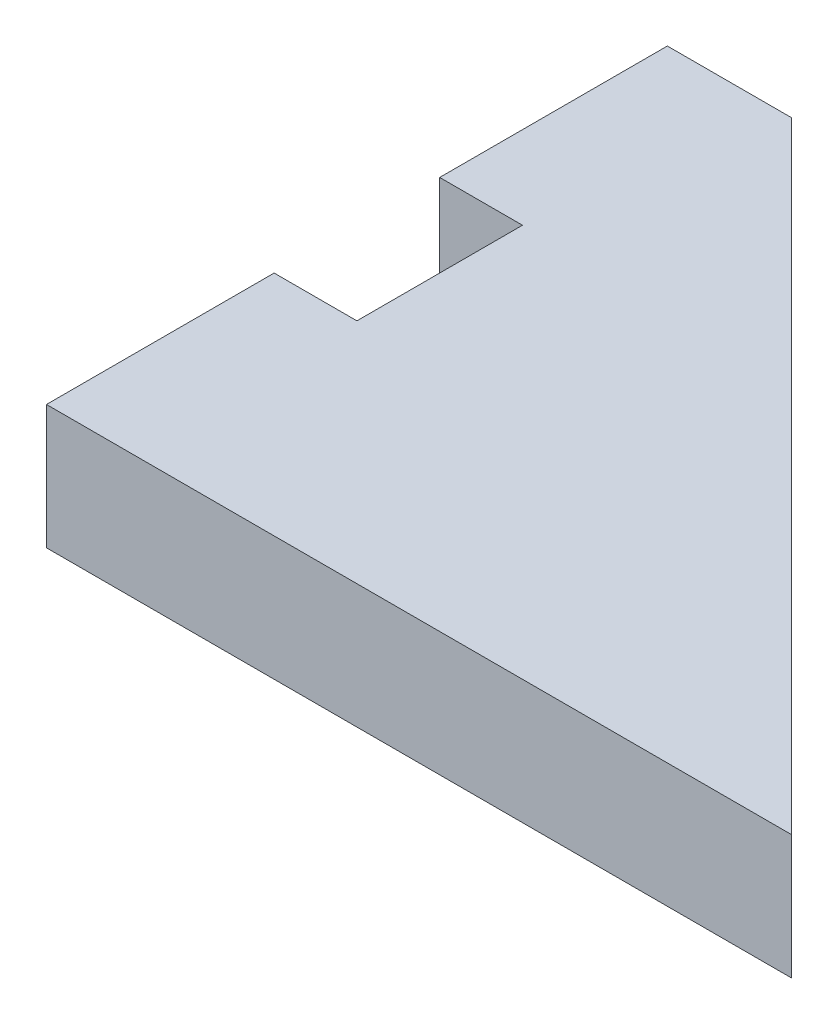
from build123d import *

# Parameters (mm, degrees)
BOSS_EXTRUDE1_DEPTH = 0.3


with BuildPart() as part:
    # Sketch1 → Boss-Extrude1 (new body)
    with BuildSketch(Plane(origin=(0, 0, 0), x_dir=(1, 0, 0), z_dir=(0, 1, 0))):
        Polygon((0, 0), (-1.5, 1.5), (-1.8, 1.5), (-1.8, 0.95), (-1.6, 0.95), (-1.6, 0.55), (-1.8, 0.55), (-1.8, 0), align=None)
    extrude(amount=BOSS_EXTRUDE1_DEPTH)


solid = part.part
